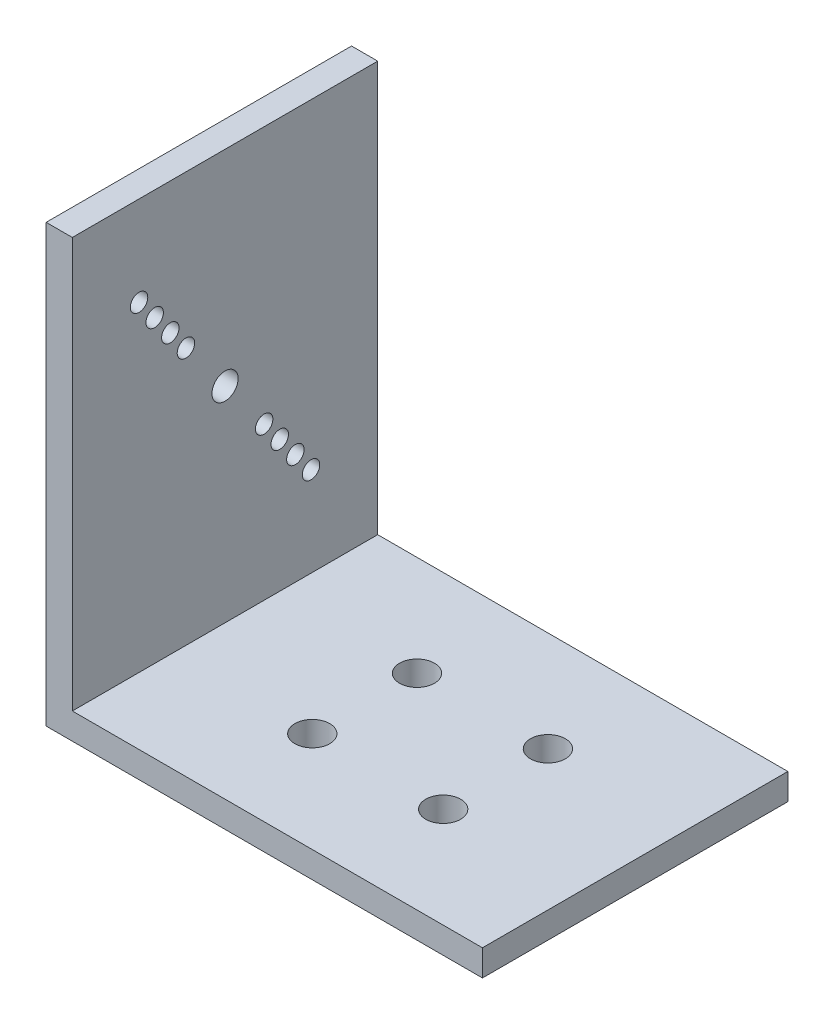
from build123d import *

# Parameters (mm, degrees)
BOSS_EXTRUDE1_DEPTH = 35
SKETCH2_R           = 2
CUT_EXTRUDE1_DEPTH  = 50
SKETCH3_R           = 1.5
SKETCH3_R_2         = 1
CUT_EXTRUDE2_DEPTH  = 50


with BuildPart() as part:
    # Sketch1 → Boss-Extrude1 (new body)
    with BuildSketch(Plane.XY):
        Polygon((0, 50), (0, 0), (50, 0), (50, 3), (3, 3), (3, 50), align=None)
    extrude(amount=BOSS_EXTRUDE1_DEPTH)

    # Sketch2 → Cut-Extrude1 (cut)
    with BuildSketch(Plane(origin=(0, 3, 0), x_dir=(1, 0, 0), z_dir=(0, 1, 0))):
        with Locations(Location((19, -11.5, 0), (0, 0, 270))):
            Circle(SKETCH2_R)
        with Locations(Location((34, -11.5, 0), (0, 0, 270))):
            Circle(SKETCH2_R)
        with Locations(Location((34, -23.5, 0), (0, 0, 270))):
            Circle(SKETCH2_R)
        with Locations(Location((19, -23.5, 0), (0, 0, 270))):
            Circle(SKETCH2_R)
    extrude(amount=-CUT_EXTRUDE1_DEPTH, mode=Mode.SUBTRACT)

    # Sketch3 → Cut-Extrude2 (cut)
    with BuildSketch(Plane(origin=(3, 0, 0), x_dir=(0, 0, -1), z_dir=(1, 0, 0))):
        with Locations((-17.5, 26.5)):
            Circle(SKETCH3_R)
        with Locations((-13.020503905, 20.484676672)):
            Circle(SKETCH3_R_2)
        with Locations((-21.979496095, 32.515323328)):
            Circle(SKETCH3_R_2)
        with Locations((-23.771294533, 34.921452659)):
            Circle(SKETCH3_R_2)
        with Locations((-25.563092971, 37.32758199)):
            Circle(SKETCH3_R_2)
        with Locations((-27.354891409, 39.733711321)):
            Circle(SKETCH3_R_2)
        with Locations((-11.228705467, 18.078547341)):
            Circle(SKETCH3_R_2)
        with Locations((-9.436907029, 15.67241801)):
            Circle(SKETCH3_R_2)
        with Locations((-7.645108591, 13.266288679)):
            Circle(SKETCH3_R_2)
    extrude(amount=-CUT_EXTRUDE2_DEPTH, mode=Mode.SUBTRACT)


solid = part.part
